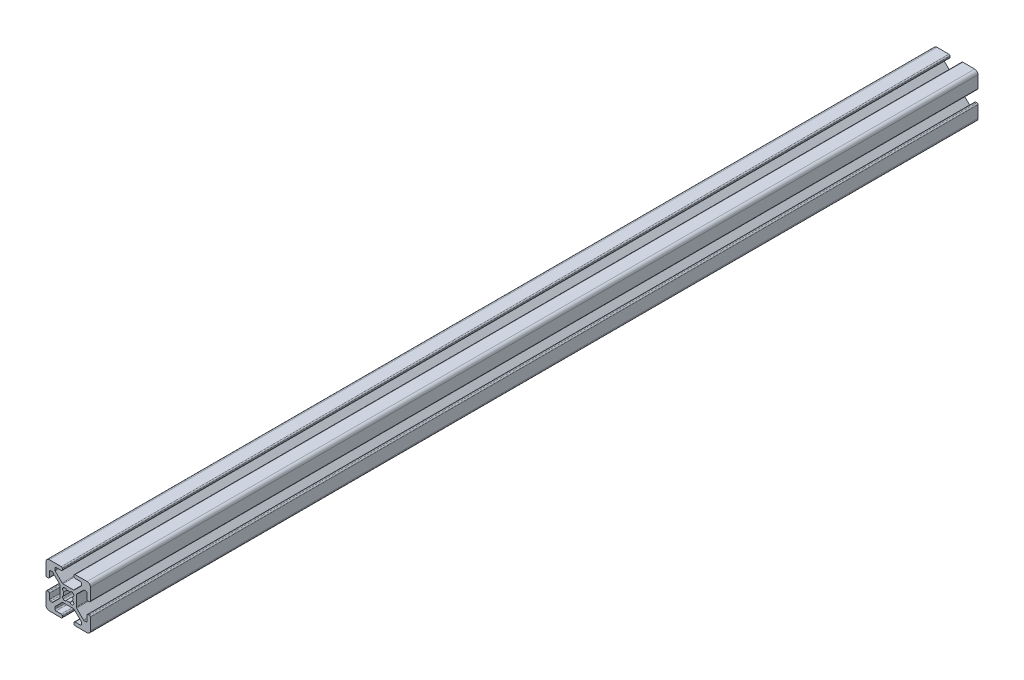
from build123d import *

# Parameters (mm, degrees)
BOSS_EXTRUDE1_DEPTH = 400


with BuildPart() as part:
    # Sketch1 → Boss-Extrude1 (new body)
    with BuildSketch(Plane(origin=(0, 0, -400), x_dir=(-1, 0, 0), z_dir=(0, 0, -1))):
        with BuildLine():
            Line((10, -8.5), (10, -3.138))
            ThreePointArc((10, -3.138), (9.851210245, -2.778789755), (9.492, -2.63))
            Line((9.492, -2.63), (9.008, -2.63))
            ThreePointArc((9.008, -2.63), (8.648789755, -2.778789755), (8.5, -3.138))
            Line((8.5, -3.138), (8.5, -5.487))
            ThreePointArc((8.5, -5.487), (8.351210245, -5.846210245), (7.992, -5.995))
            Line((7.992, -5.995), (7.26592049, -5.995))
            ThreePointArc((7.26592049, -5.995), (7.071517306, -5.956330803), (6.906710245, -5.846210245))
            Line((6.906710245, -5.846210245), (3.803789755, -2.743289755))
            ThreePointArc((3.803789755, -2.743289755), (3.693669197, -2.578482694), (3.655, -2.38407951))
            Line((3.655, -2.38407951), (3.655, 2.383759167))
            ThreePointArc((3.655, 2.383759167), (3.693669197, 2.57816235), (3.803789755, 2.742969412))
            Line((3.803789755, 2.742969412), (6.907030588, 5.846210245))
            ThreePointArc((6.907030588, 5.846210245), (7.07183765, 5.956330803), (7.266240833, 5.995))
            Line((7.266240833, 5.995), (7.992, 5.995))
            ThreePointArc((7.992, 5.995), (8.351210245, 5.846210245), (8.5, 5.487))
            Line((8.5, 5.487), (8.5, 3.138))
            ThreePointArc((8.5, 3.138), (8.648789755, 2.778789755), (9.008, 2.63))
            Line((9.008, 2.63), (9.492, 2.63))
            ThreePointArc((9.492, 2.63), (9.851210245, 2.778789755), (10, 3.138))
            Line((10, 3.138), (10, 8.5))
            ThreePointArc((10, 8.5), (9.560660172, 9.560660172), (8.5, 10))
            Line((8.5, 10), (3.138, 10))
            ThreePointArc((3.138, 10), (2.778789755, 9.851210245), (2.63, 9.492))
            Line((2.63, 9.492), (2.63, 9.008))
            ThreePointArc((2.63, 9.008), (2.778789755, 8.648789755), (3.138, 8.5))
            Line((3.138, 8.5), (5.487, 8.5))
            ThreePointArc((5.487, 8.5), (5.846210245, 8.351210245), (5.995, 7.992))
            Line((5.995, 7.992), (5.995, 7.26592049))
            ThreePointArc((5.995, 7.26592049), (5.956330803, 7.071517306), (5.846210245, 6.906710245))
            Line((5.846210245, 6.906710245), (2.743289755, 3.803789755))
            ThreePointArc((2.743289755, 3.803789755), (2.578482694, 3.693669197), (2.38407951, 3.655))
            Line((2.38407951, 3.655), (-2.383759167, 3.655))
            ThreePointArc((-2.383759167, 3.655), (-2.57816235, 3.693669197), (-2.742969412, 3.803789755))
            Line((-2.742969412, 3.803789755), (-5.846210245, 6.907030588))
            ThreePointArc((-5.846210245, 6.907030588), (-5.956330803, 7.07183765), (-5.995, 7.266240833))
            Line((-5.995, 7.266240833), (-5.995, 7.992))
            ThreePointArc((-5.995, 7.992), (-5.846210245, 8.351210245), (-5.487, 8.5))
            Line((-5.487, 8.5), (-3.138, 8.5))
            ThreePointArc((-3.138, 8.5), (-2.778789755, 8.648789755), (-2.63, 9.008))
            Line((-2.63, 9.008), (-2.63, 9.492))
            ThreePointArc((-2.63, 9.492), (-2.778789755, 9.851210245), (-3.138, 10))
            Line((-3.138, 10), (-8.5, 10))
            ThreePointArc((-8.5, 10), (-9.560660172, 9.560660172), (-10, 8.5))
            Line((-10, 8.5), (-10, 3.138))
            ThreePointArc((-10, 3.138), (-9.851210245, 2.778789755), (-9.492, 2.63))
            Line((-9.492, 2.63), (-9.008, 2.63))
            ThreePointArc((-9.008, 2.63), (-8.648789755, 2.778789755), (-8.5, 3.138))
            Line((-8.5, 3.138), (-8.5, 5.487))
            ThreePointArc((-8.5, 5.487), (-8.351210245, 5.846210245), (-7.992, 5.995))
            Line((-7.992, 5.995), (-7.26592049, 5.995))
            ThreePointArc((-7.26592049, 5.995), (-7.071517306, 5.956330803), (-6.906710245, 5.846210245))
            Line((-6.906710245, 5.846210245), (-3.803789755, 2.743289755))
            ThreePointArc((-3.803789755, 2.743289755), (-3.693669197, 2.578482694), (-3.655, 2.38407951))
            Line((-3.655, 2.38407951), (-3.655, -2.383759167))
            ThreePointArc((-3.655, -2.383759167), (-3.693669197, -2.57816235), (-3.803789755, -2.742969412))
            Line((-3.803789755, -2.742969412), (-6.907030588, -5.846210245))
            ThreePointArc((-6.907030588, -5.846210245), (-7.07183765, -5.956330803), (-7.266240833, -5.995))
            Line((-7.266240833, -5.995), (-7.992, -5.995))
            ThreePointArc((-7.992, -5.995), (-8.351210245, -5.846210245), (-8.5, -5.487))
            Line((-8.5, -5.487), (-8.5, -3.138))
            ThreePointArc((-8.5, -3.138), (-8.648789755, -2.778789755), (-9.008, -2.63))
            Line((-9.008, -2.63), (-9.492, -2.63))
            ThreePointArc((-9.492, -2.63), (-9.851210245, -2.778789755), (-10, -3.138))
            Line((-10, -3.138), (-10, -8.5))
            ThreePointArc((-10, -8.5), (-9.560660172, -9.560660172), (-8.5, -10))
            Line((-8.5, -10), (-3.138, -10))
            ThreePointArc((-3.138, -10), (-2.778789755, -9.851210245), (-2.63, -9.492))
            Line((-2.63, -9.492), (-2.63, -9.008))
            ThreePointArc((-2.63, -9.008), (-2.778789755, -8.648789755), (-3.138, -8.5))
            Line((-3.138, -8.5), (-5.487, -8.5))
            ThreePointArc((-5.487, -8.5), (-5.846210245, -8.351210245), (-5.995, -7.992))
            Line((-5.995, -7.992), (-5.995, -7.26592049))
            ThreePointArc((-5.995, -7.26592049), (-5.956330803, -7.071517306), (-5.846210245, -6.906710245))
            Line((-5.846210245, -6.906710245), (-2.743289755, -3.803789755))
            ThreePointArc((-2.743289755, -3.803789755), (-2.578482694, -3.693669197), (-2.38407951, -3.655))
            Line((-2.38407951, -3.655), (2.383759167, -3.655))
            ThreePointArc((2.383759167, -3.655), (2.57816235, -3.693669197), (2.742969412, -3.803789755))
            Line((2.742969412, -3.803789755), (5.846210245, -6.907030588))
            ThreePointArc((5.846210245, -6.907030588), (5.956330803, -7.07183765), (5.995, -7.266240833))
            Line((5.995, -7.266240833), (5.995, -7.992))
            ThreePointArc((5.995, -7.992), (5.846210245, -8.351210245), (5.487, -8.5))
            Line((5.487, -8.5), (3.138, -8.5))
            ThreePointArc((3.138, -8.5), (2.778789755, -8.648789755), (2.63, -9.008))
            Line((2.63, -9.008), (2.63, -9.492))
            ThreePointArc((2.63, -9.492), (2.778789755, -9.851210245), (3.138, -10))
            Line((3.138, -10), (8.5, -10))
            ThreePointArc((8.5, -10), (9.560660172, -9.560660172), (10, -8.5))
        make_face()
        with BuildLine():
            Line((2.304493037, -2.124493037), (2.124493037, -2.304493037))
            ThreePointArc((2.124493037, -2.304493037), (1.35638567, -2.506016078), (0.803729988, -1.935777391))
            ThreePointArc((0.803729988, -1.935777391), (0, -2.096), (-0.803729988, -1.935777391))
            ThreePointArc((-0.803729988, -1.935777391), (-1.35638567, -2.506016078), (-2.124493037, -2.304493037))
            Line((-2.124493037, -2.304493037), (-2.304493037, -2.124493037))
            ThreePointArc((-2.304493037, -2.124493037), (-2.506016078, -1.35638567), (-1.935777391, -0.803729988))
            ThreePointArc((-1.935777391, -0.803729988), (-2.096, 0), (-1.935777391, 0.803729988))
            ThreePointArc((-1.935777391, 0.803729988), (-2.506016078, 1.35638567), (-2.304493037, 2.124493037))
            Line((-2.304493037, 2.124493037), (-2.124493037, 2.304493037))
            ThreePointArc((-2.124493037, 2.304493037), (-1.35638567, 2.506016078), (-0.803729988, 1.935777391))
            ThreePointArc((-0.803729988, 1.935777391), (0, 2.096), (0.803729988, 1.935777391))
            ThreePointArc((0.803729988, 1.935777391), (1.35638567, 2.506016078), (2.124493037, 2.304493037))
            Line((2.124493037, 2.304493037), (2.304493037, 2.124493037))
            ThreePointArc((2.304493037, 2.124493037), (2.506016078, 1.35638567), (1.935777391, 0.803729988))
            ThreePointArc((1.935777391, 0.803729988), (2.096, 0), (1.935777391, -0.803729988))
            ThreePointArc((1.935777391, -0.803729988), (2.506016078, -1.35638567), (2.304493037, -2.124493037))
        make_face(mode=Mode.SUBTRACT)
    extrude(amount=-BOSS_EXTRUDE1_DEPTH)


solid = part.part
